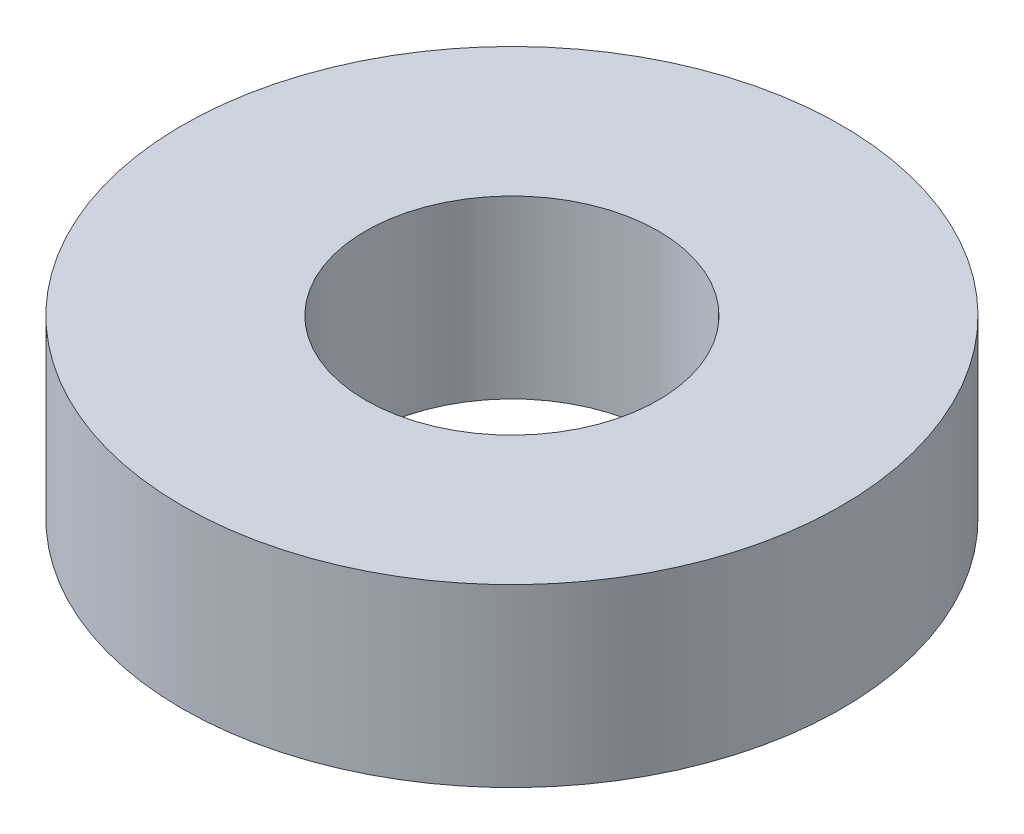
from build123d import *

# Parameters (mm, degrees)
SKETCH1_R           = 22.5
SKETCH1_R_2         = 10
BOSS_EXTRUDE1_DEPTH = 12


with BuildPart() as part:
    # Sketch1 → Boss-Extrude1 (new body)
    with BuildSketch(Plane(origin=(0, 0, 0), x_dir=(1, 0, 0), z_dir=(0, 1, 0))):
        with Locations(Location((0, 0, 0), (0, 0, 270))):
            Circle(SKETCH1_R)
        with Locations(Location((0, 0, 0), (0, 0, 270))):
            Circle(SKETCH1_R_2, mode=Mode.SUBTRACT)
    extrude(amount=BOSS_EXTRUDE1_DEPTH)


solid = part.part
